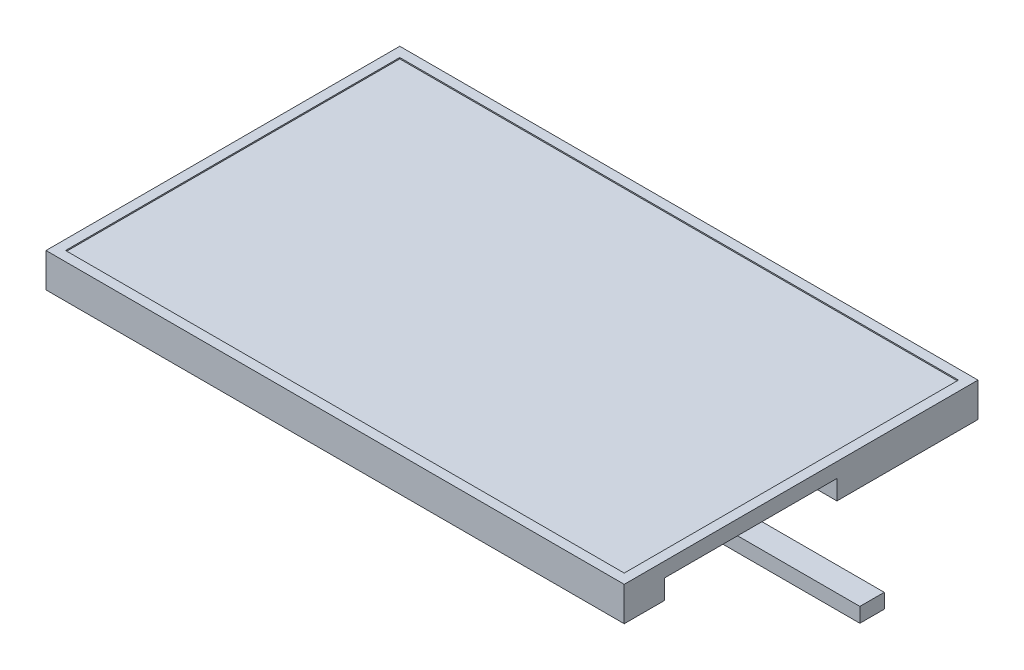
from build123d import *

# Parameters (mm, degrees)
SKETCH_1_W          = 237
SKETCH_1_H          = 145
EXTRUDE_1_DEPTH     = 14
SKETCH_2_R          = 2
SKETCH_2_R_2        = 3
CUT_EXTRUDE_1_DEPTH = 4
SKETCH_3_W          = 31.876725666
SKETCH_3_H          = 70.670873742
CUT_EXTRUDE_2_DEPTH = 8
SKETCH_4_W          = 229
SKETCH_4_H          = 137
CUT_EXTRUDE_3_DEPTH = 0.5
SKETCH_5_W          = 10
SKETCH_5_H          = 6
EXTRUDE_2_DEPTH     = 80


with BuildPart() as part:
    # 草图1 → 凸台-拉伸1 (new body)
    with BuildSketch(Plane(origin=(0, 0, 0), x_dir=(1, 0, 0), z_dir=(0, 1, 0))):
        with Locations((0, 72.5)):
            Rectangle(SKETCH_1_W, SKETCH_1_H)
    extrude(amount=EXTRUDE_1_DEPTH)

    # 草图2 → 切除-拉伸1 (cut)
    with BuildSketch(Plane.XZ):
        with Locations(Location((37.5, -110, 0), (0, 0, 270))):
            Circle(SKETCH_2_R)
        with Locations(Location((-37.5, -110, 0), (0, 0, 270))):
            Circle(SKETCH_2_R)
        with Locations(Location((-37.5, -35, 0), (0, 0, 270))):
            Circle(SKETCH_2_R)
        with Locations(Location((37.5, -35, 0), (0, 0, 270))):
            Circle(SKETCH_2_R)
        with Locations(Location((0, -24, 0), (0, 0, 270))):
            Circle(SKETCH_2_R_2)
    extrude(amount=-CUT_EXTRUDE_1_DEPTH, mode=Mode.SUBTRACT)

    # 草图3 → 切除-拉伸2 (cut)
    with BuildSketch(Plane.XZ):
        with Locations((102.561637167, -51.846473886)):
            Rectangle(SKETCH_3_W, SKETCH_3_H)
    extrude(amount=-CUT_EXTRUDE_2_DEPTH, mode=Mode.SUBTRACT)

    # 草图4 → 切除-拉伸3 (cut)
    with BuildSketch(Plane(origin=(0, 14, 0), x_dir=(1, 0, 0), z_dir=(0, 1, 0))):
        with Locations((0, 72.5)):
            Rectangle(SKETCH_4_W, SKETCH_4_H)
    extrude(amount=-CUT_EXTRUDE_3_DEPTH, mode=Mode.SUBTRACT)

    # 草图5 → 凸台-拉伸2 (add)
    with BuildSketch(Plane(origin=(86.623274334, 0, 0), x_dir=(0, 0, -1), z_dir=(1, 0, 0))):
        with Locations((53.458325759, 3)):
            Rectangle(SKETCH_5_W, SKETCH_5_H)
    extrude(amount=EXTRUDE_2_DEPTH)


solid = part.part
